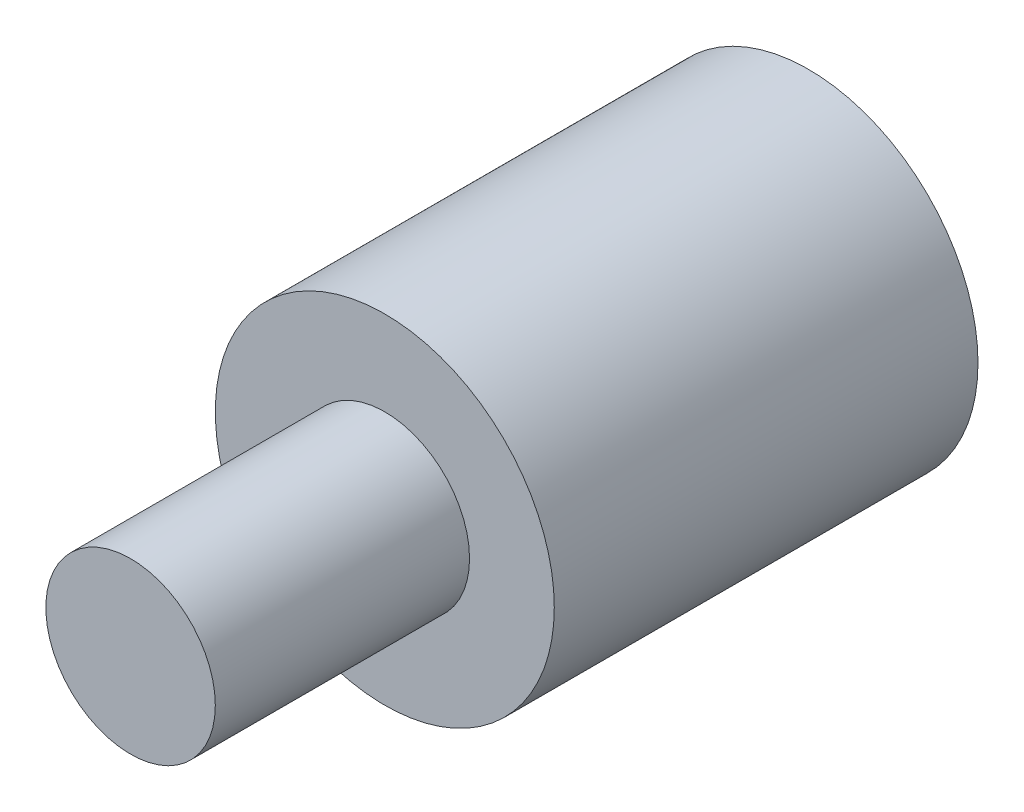
from build123d import *

# Parameters (mm, degrees)
SKETCH1_R           = 20
BOSS_EXTRUDE1_DEPTH = 50
SKETCH4_R           = 10
BOSS_EXTRUDE2_DEPTH = 30


with BuildPart() as part:
    # Sketch1 → Boss-Extrude1 (new body)
    with BuildSketch(Plane.XY):
        Circle(SKETCH1_R)
    extrude(amount=BOSS_EXTRUDE1_DEPTH)

    # Sketch4 → Boss-Extrude2 (add)
    with BuildSketch(Plane.XY.offset(50)):
        Circle(SKETCH4_R)
    extrude(amount=BOSS_EXTRUDE2_DEPTH)


solid = part.part
